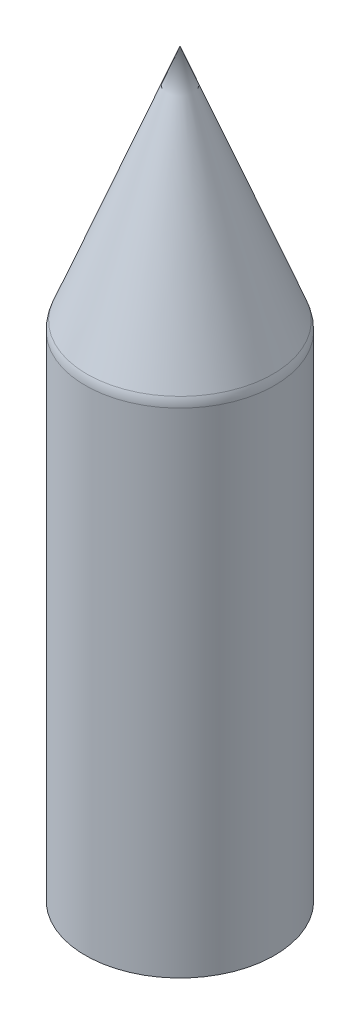
from build123d import *


with BuildPart() as part:
    # Szkic1 → Obrót1 (revolve)
    with BuildSketch(Plane.XY, mode=Mode.PRIVATE) as obr_t1_sk:
        with BuildLine():
            Line((0, 0), (0, 900))
            Line((0, 900), (112.94306217, 610.917200948))
            ThreePointArc((112.94306217, 610.917200948), (114.481281053, 605.554643773), (115, 600))
            Line((115, 600), (115, 0))
            Line((115, 0), (0, 0))
        make_face()
    revolve(obr_t1_sk.sketch.rotate(Axis((0, 0, 0), (0, 1, 0)), 90), axis=Axis((0, 0, 0), (0, 1, 0)))


solid = part.part
